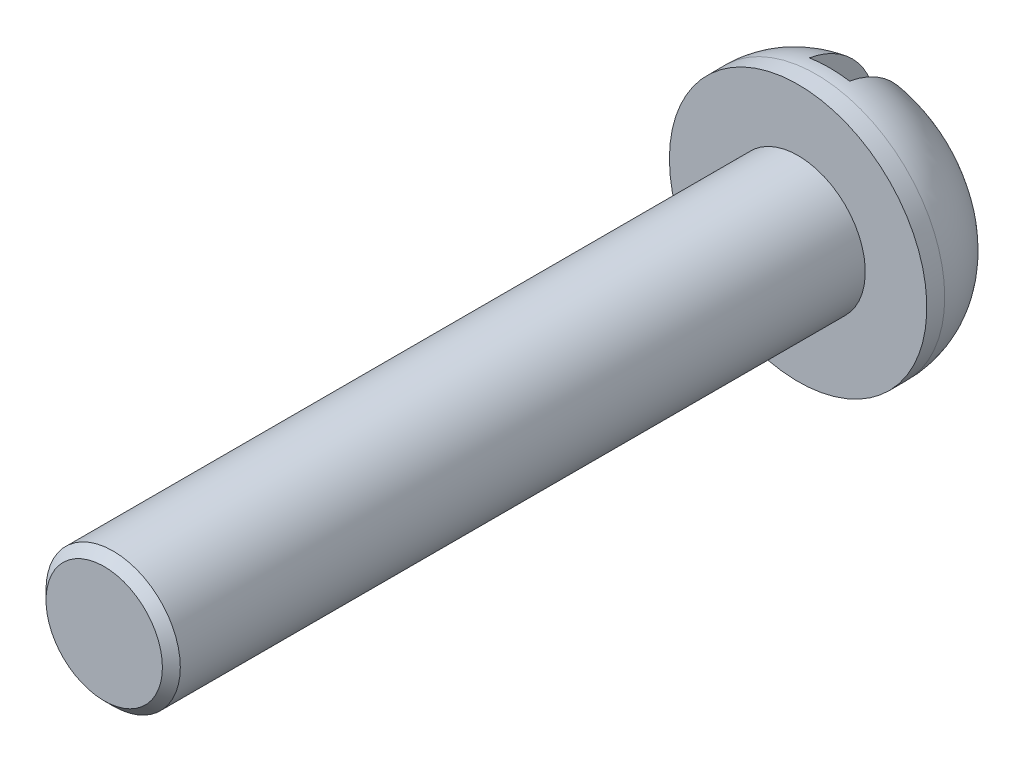
from build123d import *

# Parameters (mm, degrees)
ESBO_O1_R                = 1.5
RESSALTO_EXTRUS_O1_DEPTH = 17.7
ESBO_O2_R                = 2.875
RESSALTO_EXTRUS_O2_DEPTH = 2.2
FILETE1_R                = 1.8
ESBO_O3_W                = 0.9
ESBO_O3_H                = 6.121542056
CORTE_EXTRUS_O1_DEPTH    = 1.5
CHANFRO1_SIZE            = 0.2


with BuildPart() as part:
    # Esboço1 → Ressalto-extrusão1 (new body)
    with BuildSketch(Plane.XY):
        Circle(ESBO_O1_R)
    extrude(amount=RESSALTO_EXTRUS_O1_DEPTH)

    # Esboço2 → Ressalto-extrusão2 (add)
    with BuildSketch(Plane(origin=(0, 0, 0), x_dir=(-1, 0, 0), z_dir=(0, 0, -1))):
        Circle(ESBO_O2_R)
    extrude(amount=-RESSALTO_EXTRUS_O2_DEPTH)

    # Filete1
    filete1_edges = [part.edges().sort_by_distance(p)[0] for p in [
        (2.875, 0, 0),
    ]]
    fillet(filete1_edges, radius=FILETE1_R)

    # Esboço3 → Corte-extrusão1 (cut)
    with BuildSketch(Plane(origin=(0, 0, 0), x_dir=(-1, 0, 0), z_dir=(0, 0, -1))):
        Rectangle(ESBO_O3_W, ESBO_O3_H)
    extrude(amount=-CORTE_EXTRUS_O1_DEPTH, mode=Mode.SUBTRACT)

    # Chanfro1
    chanfro1_edges = [part.edges().sort_by_distance(p)[0] for p in [
        (-1.5, 0, 17.7),
    ]]
    chamfer(chanfro1_edges, length=CHANFRO1_SIZE)


solid = part.part
